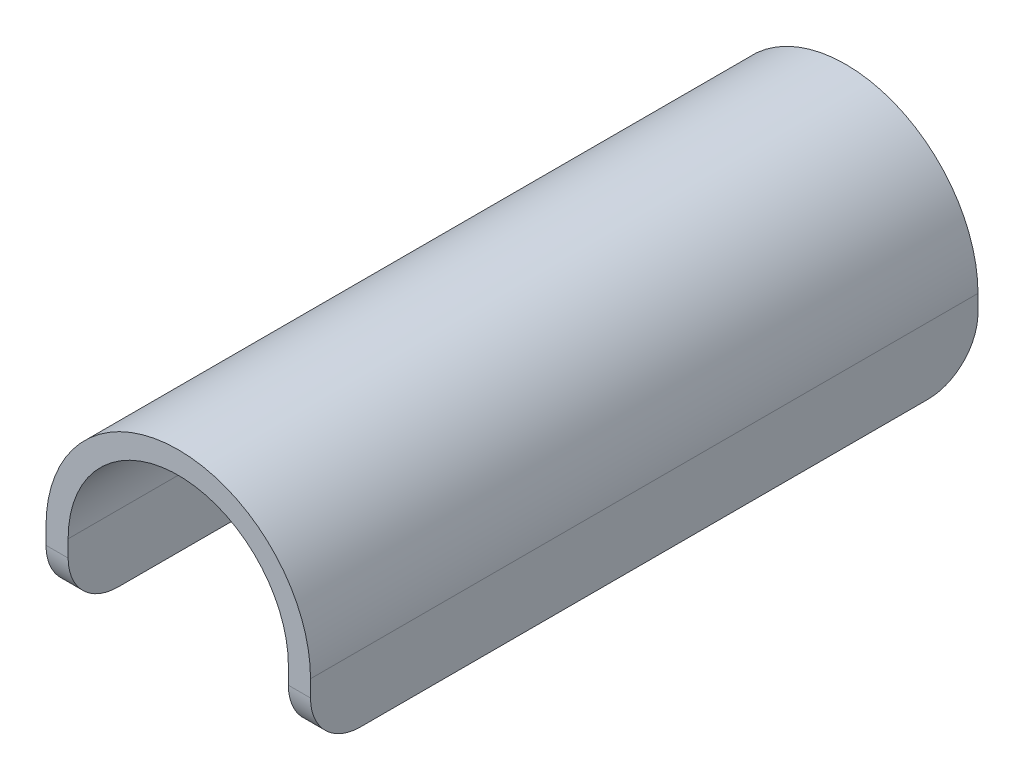
from build123d import *

# Parameters (mm, degrees)
ESTRUSIONE_ESTRUSIONE2_DEPTH = 200
SCHIZZO2_W                   = 6.628026169
SCHIZZO2_H                   = 20
ESTRUSIONE_ESTRUSIONE3_DEPTH = 200
RACCORDO3_R                  = 15


with BuildPart() as part:
    # Schizzo1 → Estrusione-Estrusione2 (new body)
    with BuildSketch(Plane.XY):
        with BuildLine():
            Line((-39.628026169, 0), (-33, 0))
            ThreePointArc((-33, 0), (0, 33), (33, 0))
            Line((33, 0), (39.628026169, 0))
            ThreePointArc((39.628026169, 0), (0, 39.628026169), (-39.628026169, 0))
        make_face()
    extrude(amount=ESTRUSIONE_ESTRUSIONE2_DEPTH)

    # Schizzo2 → Estrusione-Estrusione3 (add)
    with BuildSketch(Plane.XY):
        with Locations((-36.314013085, -10)):
            Rectangle(SCHIZZO2_W, SCHIZZO2_H)
        with Locations((36.314013085, -10)):
            Rectangle(SCHIZZO2_W, SCHIZZO2_H)
    extrude(amount=ESTRUSIONE_ESTRUSIONE3_DEPTH)

    # Raccordo3
    raccordo3_edges = [part.edges().sort_by_distance(p)[0] for p in [
        (-36.314013085, -20, 0),
        (-36.314013085, -20, 200),
        (36.314013085, -20, 0),
        (36.314013085, -20, 200),
    ]]
    fillet(raccordo3_edges, radius=RACCORDO3_R)


solid = part.part
